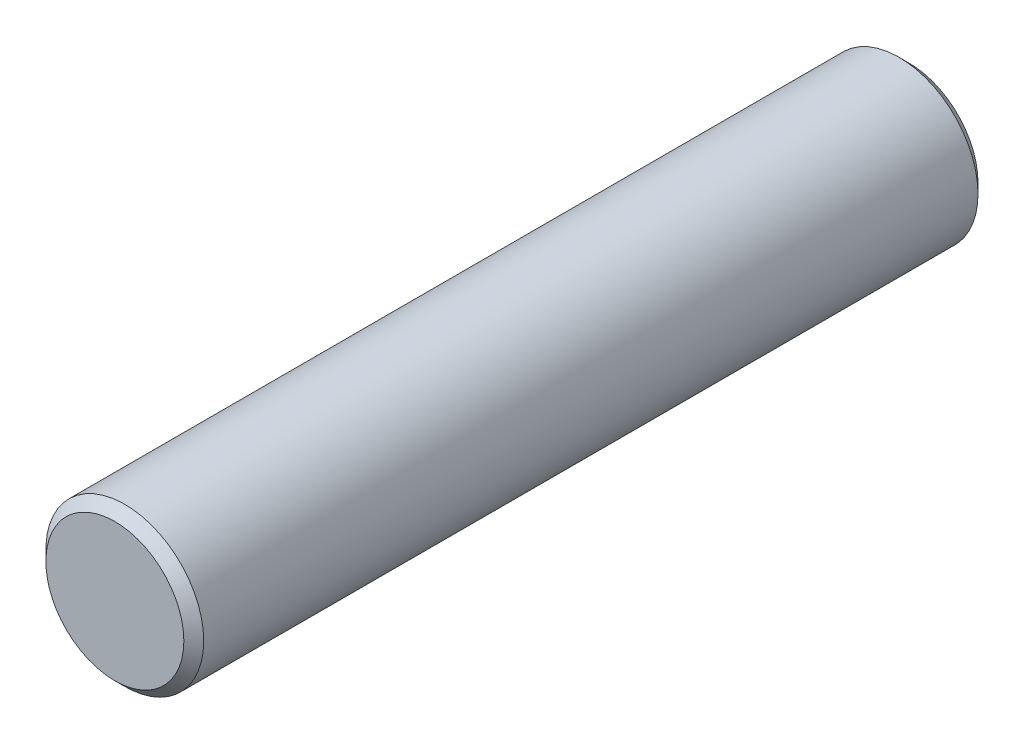
from build123d import *

# Parameters (mm, degrees)
SKETCH_1_R      = 3.975
EXTRUDE_1_DEPTH = 40
CHAMFER_1_SIZE  = 0.5


with BuildPart() as part:
    # 스케치1 → 보스-돌출1 (new body)
    with BuildSketch(Plane.XY):
        Circle(SKETCH_1_R)
    extrude(amount=EXTRUDE_1_DEPTH)

    # 모따기1
    chamfer_1_edges = [part.edges().sort_by_distance(p)[0] for p in [
        (-3.975, 0, 0),
        (-3.975, 0, 40),
    ]]
    chamfer(chamfer_1_edges, length=CHAMFER_1_SIZE)


solid = part.part
